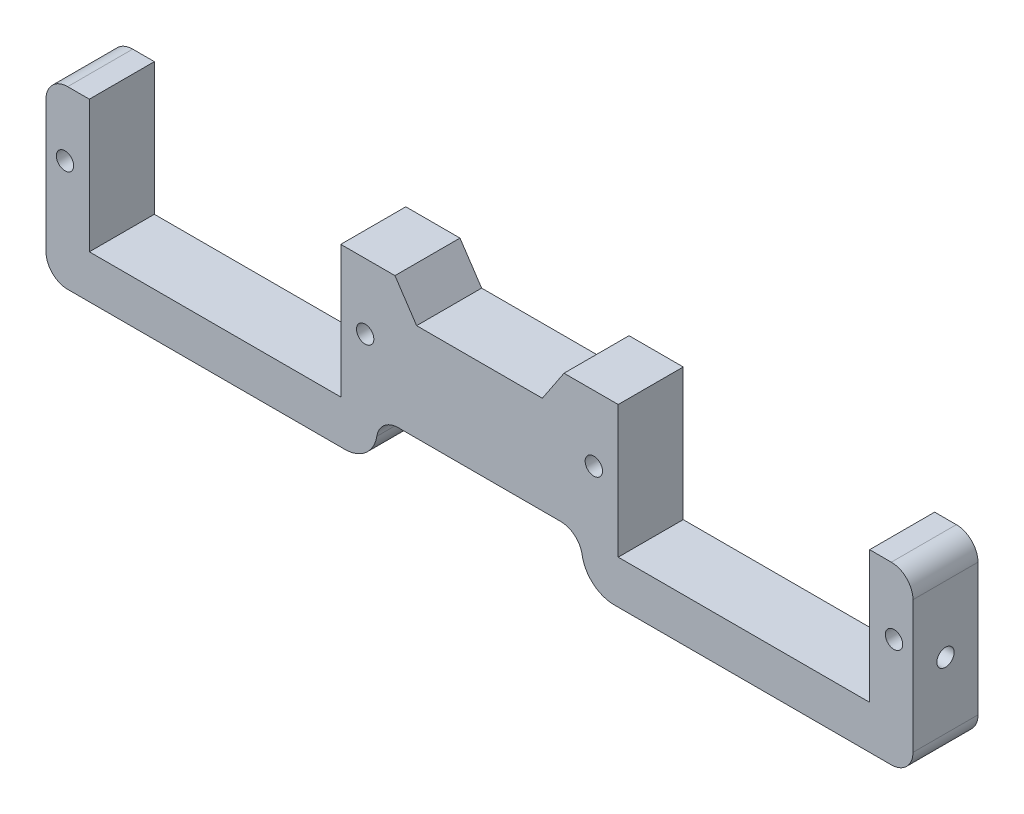
from build123d import *

# Parameters (mm, degrees)
IZIM1_R                     = 0.8
Y_KSEKLIK_EKSTR_ZYON1_DEPTH = 3
RADYUS1_R                   = 3
KES_EKSTR_ZYON5_REACH       = 83.679
IZIM6_R                     = 0.8


with BuildPart() as part:
    # Çizim1 → Yükseklik-Ekstrüzyon1 (new, symmetric)
    with BuildSketch(Plane.XY):
        with BuildLine():
            Line((-40, 2), (-40, 14.2))
            ThreePointArc((-40, 14.2), (-39.414213562, 15.614213562), (-38, 16.2))
            Line((-38, 16.2), (-36, 16.2))
            Line((-36, 16.2), (-36, 4))
            Line((-36, 4), (-12.8, 4))
            Line((-12.8, 4), (-12.8, 16.2))
            Line((-12.8, 16.2), (-7.8, 16.2))
            Line((-7.8, 16.2), (-5.8, 13.199942957))
            Line((-5.8, 13.199942957), (5.8, 13.199942957))
            Line((5.8, 13.199942957), (7.8, 16.2))
            Line((7.8, 16.2), (11, 16.2))
            Line((11, 16.2), (12.8, 16.2))
            Line((12.8, 16.2), (12.8, 4))
            Line((12.8, 4), (36, 4))
            Line((36, 4), (36, 16.2))
            Line((36, 16.2), (38, 16.2))
            ThreePointArc((38, 16.2), (39.414213562, 15.614213562), (40, 14.2))
            Line((40, 14.2), (40, 2))
            ThreePointArc((40, 2), (39.414213562, 0.585786438), (38, 0))
            Line((38, 0), (9.5, 0))
            Line((9.5, 0), (9.5, 2.199942957))
            ThreePointArc((9.5, 2.199942957), (8.914213562, 3.614156519), (7.5, 4.199942957))
            Line((7.5, 4.199942957), (-7.5, 4.199942957))
            ThreePointArc((-7.5, 4.199942957), (-8.914213562, 3.614156519), (-9.5, 2.199942957))
            Line((-9.5, 2.199942957), (-9.5, 0))
            Line((-9.5, 0), (-38, 0))
            ThreePointArc((-38, 0), (-39.414213562, 0.585786438), (-40, 2))
        make_face()
        with Locations((-10.55, 10.149944348)):
            Circle(IZIM1_R, mode=Mode.SUBTRACT)
        with Locations((-38.25, 10.149944348)):
            Circle(IZIM1_R, mode=Mode.SUBTRACT)
        with Locations(Location((38.25, 10.149944348, 0), (0, 0, 180))):
            Circle(IZIM1_R, mode=Mode.SUBTRACT)
        with Locations(Location((10.55, 10.149944348, 0), (0, 0, 180))):
            Circle(IZIM1_R, mode=Mode.SUBTRACT)
    extrude(amount=Y_KSEKLIK_EKSTR_ZYON1_DEPTH, both=True)

    # Radyus1
    radyus1_edges = [part.edges().sort_by_distance(p)[0] for p in [
        (9.5, 0, 0),
        (-9.5, 0, 0),
    ]]
    fillet(radyus1_edges, radius=RADYUS1_R)

    # Çizim6 → Kes-Ekstrüzyon5 (cut, up to next)
    with BuildSketch(Plane(origin=(40, 0, 0), x_dir=(0, 0, -1), z_dir=(1, 0, 0)), mode=Mode.PRIVATE) as kes_ekstr_zyon5_sk1:
        with Locations((0, 8.1)):
            Circle(IZIM6_R)
    kes_ekstr_zyon5_tool1 = extrude(kes_ekstr_zyon5_sk1.sketch, amount=-KES_EKSTR_ZYON5_REACH, mode=Mode.PRIVATE) & part.part
    add(kes_ekstr_zyon5_tool1.solids().sort_by_distance((40, 8.1, 0))[0], mode=Mode.SUBTRACT)


solid = part.part
